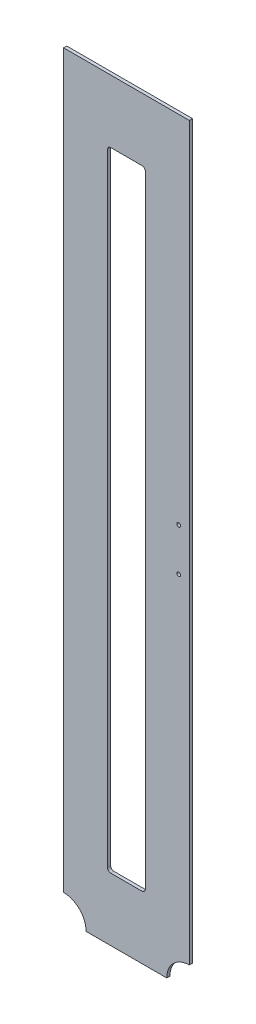
from build123d import *

# Parameters (mm, degrees)
SKETCH1_W           = 200
SKETCH1_H           = 1200
BOSS_EXTRUDE1_DEPTH = 5
CUT_EXTRUDE1_DEPTH  = 609.296802556
SKETCH5_W           = 60
SKETCH5_H           = 1000
CUT_EXTRUDE3_DEPTH  = 609.296802556
FILLET2_R           = 5
SKETCH6_R           = 3
CUT_EXTRUDE4_DEPTH  = 609.296802556


with BuildPart() as part:
    # Sketch1 → Boss-Extrude1 (new body)
    with BuildSketch(Plane.XY):
        Rectangle(SKETCH1_W, SKETCH1_H)
    extrude(amount=BOSS_EXTRUDE1_DEPTH)

    # Sketch3 → Cut-Extrude1 (cut, through all)
    with BuildSketch(Plane.XY.offset(5)):
        with BuildLine():
            Line((-100, -600), (-100, -564.197190266))
            ThreePointArc((-100, -564.197190266), (-74.683590452, -574.683590452), (-64.197190266, -600))
            Line((-64.197190266, -600), (-100, -600))
        make_face()
        with BuildLine():
            Line((64.197190266, -600), (100, -600))
            Line((100, -600), (100, -564.197190266))
            ThreePointArc((100, -564.197190266), (74.683590452, -574.683590452), (64.197190266, -600))
        make_face()
    extrude(amount=-CUT_EXTRUDE1_DEPTH, mode=Mode.SUBTRACT)

    # Sketch5 → Cut-Extrude3 (cut, through all)
    with BuildSketch(Plane.XY.offset(5)):
        Rectangle(SKETCH5_W, SKETCH5_H)
    extrude(amount=-CUT_EXTRUDE3_DEPTH, mode=Mode.SUBTRACT)

    # Fillet2
    fillet2_edges = [part.edges().sort_by_distance(p)[0] for p in [
        (30, 500, 2.5),
        (30, -500, 2.5),
        (-30, -500, 2.5),
        (-30, 500, 2.5),
    ]]
    fillet(fillet2_edges, radius=FILLET2_R)

    # Sketch6 → Cut-Extrude4 (cut, through all)
    with BuildSketch(Plane.XY.offset(5)):
        with Locations((83.193225438, -34)):
            Circle(SKETCH6_R)
        with Locations((83.193225438, 34)):
            Circle(SKETCH6_R)
    extrude(amount=-CUT_EXTRUDE4_DEPTH, mode=Mode.SUBTRACT)


solid = part.part
